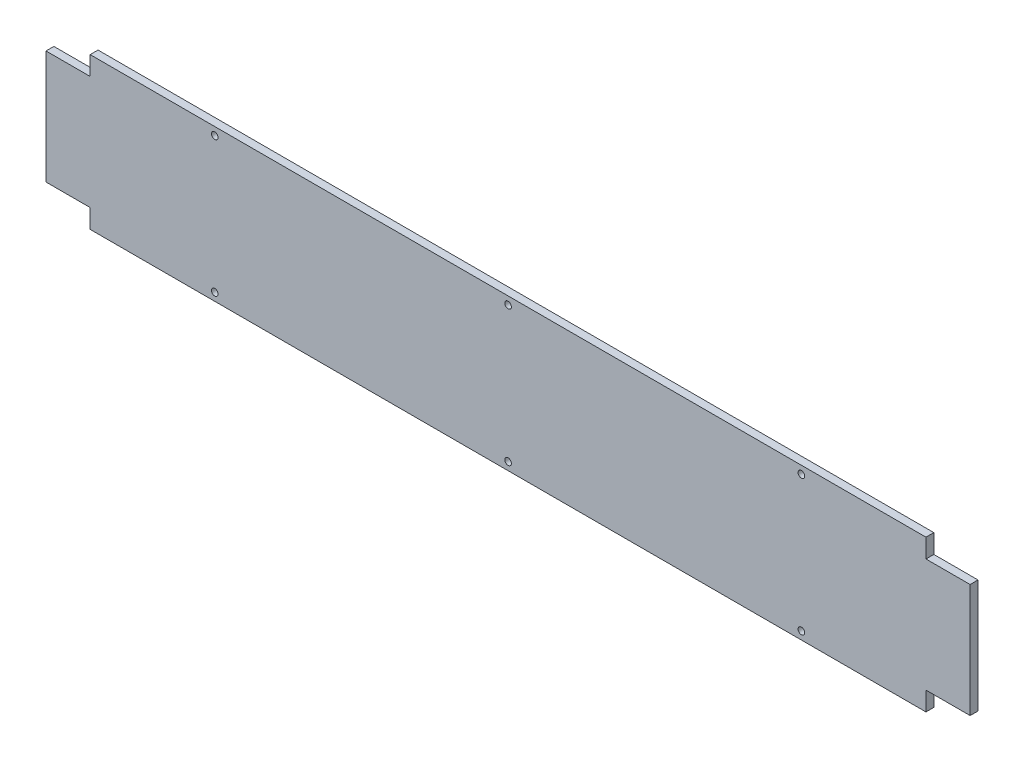
from build123d import *

# Parameters (mm, degrees)
SKETCH1_W           = 530
SKETCH1_H           = 96
BOSS_EXTRUDE1_DEPTH = 5
SKETCH2_R           = 2.1
CUT_EXTRUDE1_DEPTH  = 5
SKETCH3_W           = 28
SKETCH3_H           = 72
BOSS_EXTRUDE2_DEPTH = 5


with BuildPart() as part:
    # Sketch1 → Boss-Extrude1 (new body)
    with BuildSketch(Plane.XY):
        with Locations((265, 48)):
            Rectangle(SKETCH1_W, SKETCH1_H)
    extrude(amount=BOSS_EXTRUDE1_DEPTH)

    # Sketch2 → Cut-Extrude1 (cut)
    with BuildSketch(Plane.XY.offset(5)):
        with Locations((79, 91)):
            Circle(SKETCH2_R)
        with Locations((265, 91)):
            Circle(SKETCH2_R)
        with Locations((451, 91)):
            Circle(SKETCH2_R)
        with Locations(Location((451, 5, 0), (0, 0, 180))):
            Circle(SKETCH2_R)
        with Locations(Location((265, 5, 0), (0, 0, 180))):
            Circle(SKETCH2_R)
        with Locations(Location((79, 5, 0), (0, 0, 180))):
            Circle(SKETCH2_R)
    extrude(amount=-CUT_EXTRUDE1_DEPTH, mode=Mode.SUBTRACT)

    # Sketch3 → Boss-Extrude2 (add)
    with BuildSketch(Plane.XY.offset(5)):
        with Locations((544, 48)):
            Rectangle(SKETCH3_W, SKETCH3_H)
        with Locations((-14, 48)):
            Rectangle(SKETCH3_W, SKETCH3_H)
    extrude(amount=-BOSS_EXTRUDE2_DEPTH)


solid = part.part
